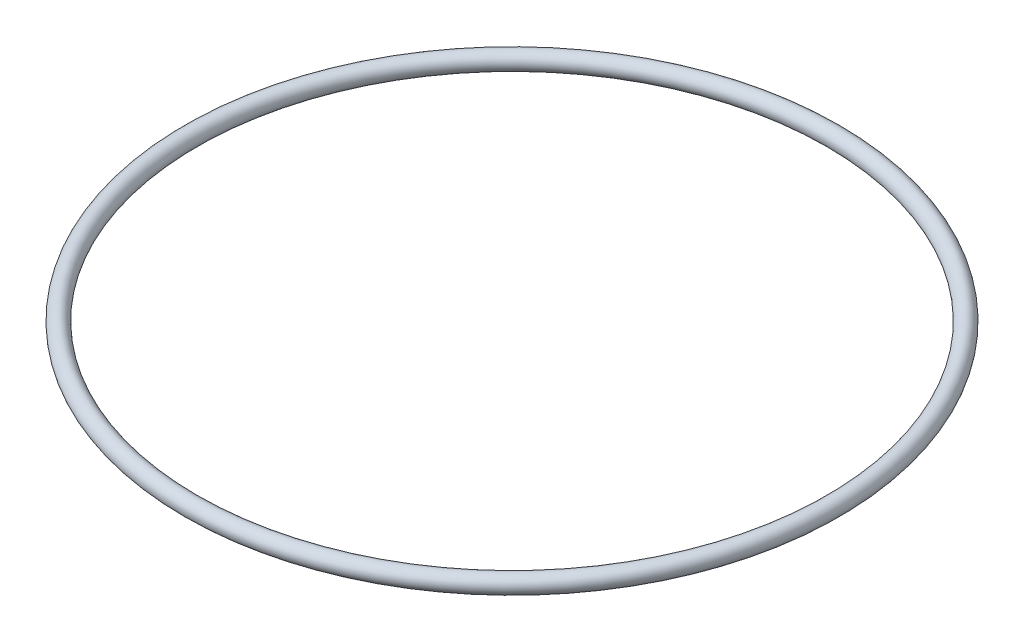
from build123d import *

# Parameters (mm, degrees)
SKETCH1_R = 1.5


with BuildPart() as part:
    # Sketch1 → Revolve1 (revolve)
    with BuildSketch(Plane(origin=(0, 0, 0), x_dir=(0, 0, -1), z_dir=(1, 0, 0))):
        with Locations((-55, 0)):
            Circle(SKETCH1_R)
    revolve(axis=Axis((0, 0, 0), (0, 1, 0)))


solid = part.part
